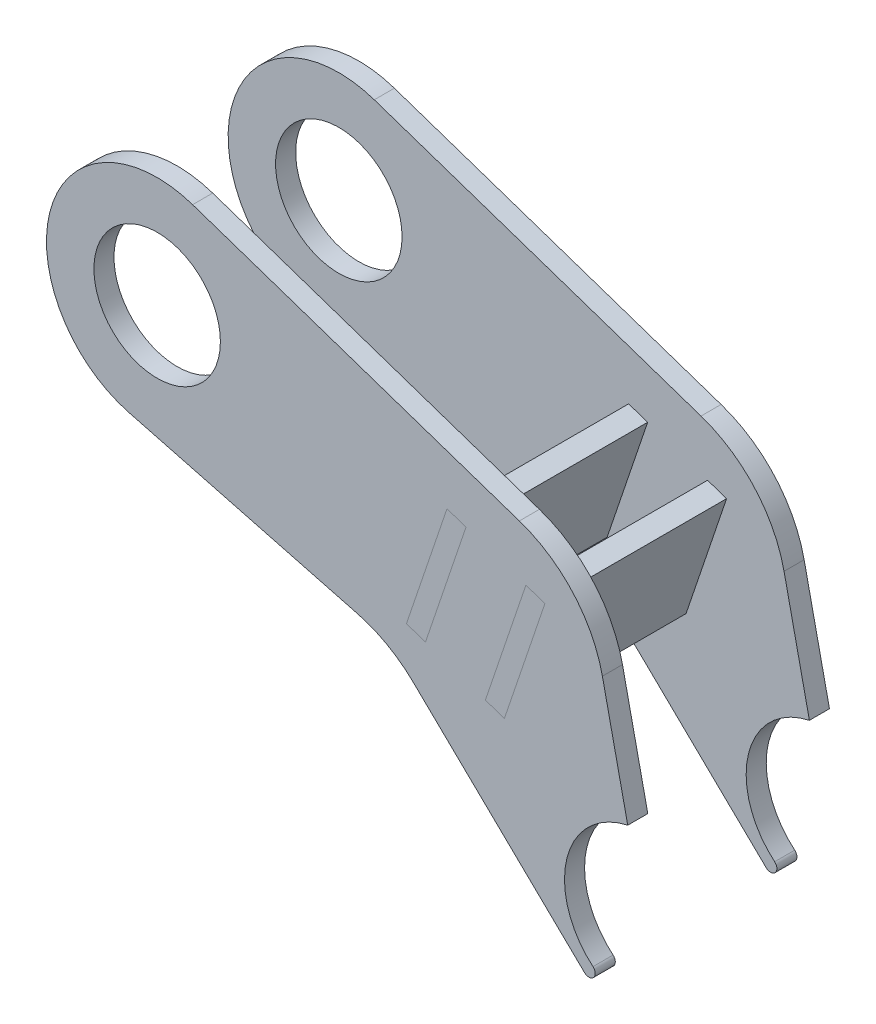
from build123d import *

# Parameters (mm, degrees)
SKETCH1_R             = 10
BOSS_EXTRUDE1_DEPTH   = 3.175
BOSS_EXTRUDE2_DEPTH   = 31.9
BOSS_EXTRUDE2_2_DEPTH = 31.9


with BuildPart() as part:
    # Sketch1 → Boss-Extrude1 (new body)
    with BuildSketch(Plane.XY):
        with BuildLine():
            Line((5.607971528, 16.577112395), (57.271414282, -0.900425857))
            ThreePointArc((57.271414282, -0.900425857), (65.773207032, -6.516594805), (70.404806539, -15.592393373))
            Line((70.404806539, -15.592393373), (74.410944882, -33.999253713))
            ThreePointArc((74.410944882, -33.999253713), (64.786854385, -43.345102314), (68.914977689, -56.109372837))
            ThreePointArc((68.914977689, -56.109372837), (69.011144361, -57.544060684), (67.574026379, -57.591696317))
            Line((67.574026379, -57.591696317), (40.479288713, -31.362848764))
            ThreePointArc((40.479288713, -31.362848764), (36.380649999, -28.305047462), (31.640575479, -26.386537192))
            Line((31.640575479, -26.386537192), (-4.437949885, -16.927923701))
            ThreePointArc((-4.437949885, -16.927923701), (-16.76272945, 5.026022423), (5.607971528, 16.577112395))
        make_face()
        Circle(SKETCH1_R, mode=Mode.SUBTRACT)
        Polygon((58.311613076, -9.169863981), (51.902502759, -28.115135289), (54.910064579, -29.132581552), (61.319174897, -10.187310244), align=None, mode=Mode.SUBTRACT)
        Polygon((45.831415602, -4.94786256), (39.422305285, -23.893133868), (42.429867105, -24.910580131), (48.838977422, -5.965308822), align=None, mode=Mode.SUBTRACT)
    extrude(amount=BOSS_EXTRUDE1_DEPTH)


with BuildPart() as body_2:
    # Mirror3: mirrored copy
    add(part.part.mirror(Plane(origin=(0, 0, -12.775), x_dir=(1, 0, 0), z_dir=(0, 0, -1))))


with BuildPart() as body_3:
    # Sketch2 → Boss-Extrude2 (new body)
    with BuildSketch(Plane.XY.offset(3.175)):
        Polygon((45.831415602, -4.94786256), (39.422305285, -23.893133868), (42.429867105, -24.910580131), (48.838977422, -5.965308822), align=None)
    extrude(amount=-BOSS_EXTRUDE2_DEPTH)


with BuildPart() as body_4:
    # Sketch2 → Boss-Extrude2 2 (new body)
    with BuildSketch(Plane.XY.offset(3.175)):
        Polygon((51.902502759, -28.115135289), (58.311613076, -9.169863981), (61.319174897, -10.187310244), (54.910064579, -29.132581552), align=None)
    extrude(amount=-BOSS_EXTRUDE2_2_DEPTH)


solid = Compound([part.part, body_2.part, body_3.part, body_4.part])
